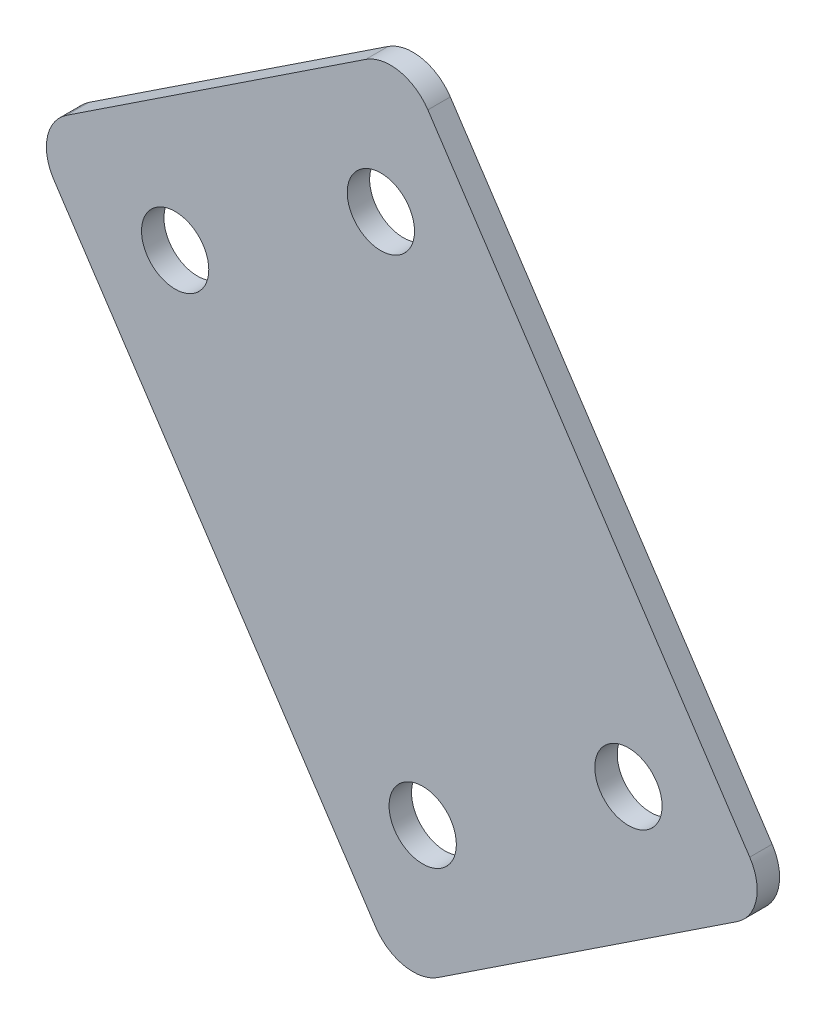
from build123d import *

# Parameters (mm, degrees)
EXTRUDE_1_DEPTH = 1


with BuildPart() as part:
    # 草图1 → 凸台-拉伸1 (new body)
    with BuildSketch(Plane.XY):
        with BuildLine():
            Line((15.51403903, -5.321145834), (1.163677412, 16.35988554))
            ThreePointArc((1.163677412, 16.35988554), (-0.105358364, 17.215860979), (-1.607968203, 16.923783214))
            Line((-1.607968203, 16.923783214), (-14.950141356, 8.092791449))
            ThreePointArc((-14.950141356, 8.092791449), (-15.806116795, 6.823755673), (-15.51403903, 5.321145834))
            Line((-15.51403903, 5.321145834), (-1.163677412, -16.35988554))
            ThreePointArc((-1.163677412, -16.35988554), (0.105358364, -17.215860979), (1.607968203, -16.923783214))
            Line((1.607968203, -16.923783214), (14.950141356, -8.092791449))
            ThreePointArc((14.950141356, -8.092791449), (15.806116795, -6.823755673), (15.51403903, -5.321145834))
        make_face()
        with BuildLine():
            ThreePointArc((11.356570608, -4.475299323), (9.277836397, -4.052376068), (8.854913141, -6.131110279))
            ThreePointArc((8.854913141, -6.131110279), (10.933647352, -6.554033535), (11.356570608, -4.475299323))
        make_face(mode=Mode.SUBTRACT)
        with BuildLine():
            ThreePointArc((2.183826565, -10.546606162), (0.105092354, -10.123682907), (-0.317830901, -12.202417118))
            ThreePointArc((-0.317830901, -12.202417118), (1.76090331, -12.625340373), (2.183826565, -10.546606162))
        make_face(mode=Mode.SUBTRACT)
        with BuildLine():
            ThreePointArc((-8.854913141, 6.131110279), (-10.933647352, 6.554033535), (-11.356570608, 4.475299323))
            ThreePointArc((-11.356570608, 4.475299323), (-9.277836397, 4.052376068), (-8.854913141, 6.131110279))
        make_face(mode=Mode.SUBTRACT)
        with BuildLine():
            ThreePointArc((0.317830901, 12.202417118), (-1.76090331, 12.625340373), (-2.183826565, 10.546606162))
            ThreePointArc((-2.183826565, 10.546606162), (-0.105092354, 10.123682907), (0.317830901, 12.202417118))
        make_face(mode=Mode.SUBTRACT)
    extrude(amount=EXTRUDE_1_DEPTH)


solid = part.part
